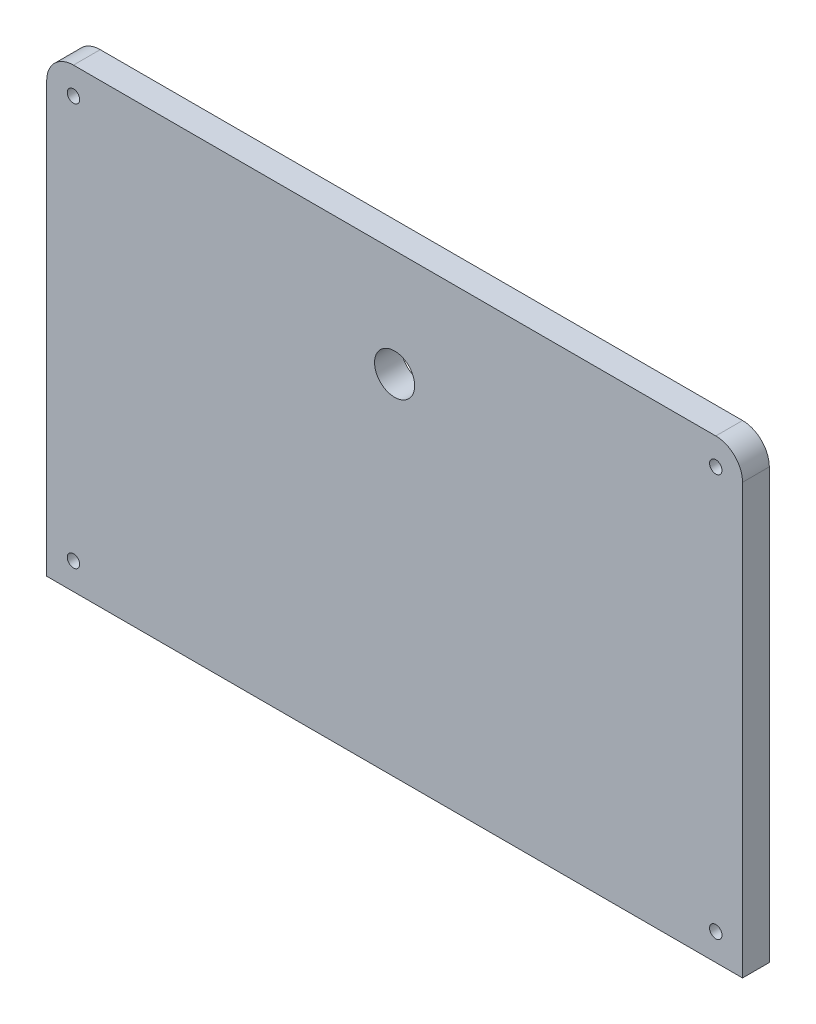
from build123d import *

# Parameters (mm, degrees)
SKETCH1_R           = 1.4732
SKETCH1_R_2         = 4.7625
BOSS_EXTRUDE1_DEPTH = 6.35


with BuildPart() as part:
    # Sketch1 → Boss-Extrude1 (new body)
    with BuildSketch(Plane.XY):
        with BuildLine():
            Line((0, 0), (0, 101.854))
            ThreePointArc((0, 101.854), (1.859871939, 106.344128061), (6.35, 108.204))
            Line((6.35, 108.204), (158.75, 108.204))
            ThreePointArc((158.75, 108.204), (163.240128061, 106.344128061), (165.1, 101.854))
            Line((165.1, 101.854), (165.1, 0))
            Line((165.1, 0), (0, 0))
        make_face()
        with Locations((6.35, 6.35)):
            Circle(SKETCH1_R, mode=Mode.SUBTRACT)
        with Locations((158.75, 6.35)):
            Circle(SKETCH1_R, mode=Mode.SUBTRACT)
        with Locations((158.75, 101.854)):
            Circle(SKETCH1_R, mode=Mode.SUBTRACT)
        with Locations((6.35, 101.854)):
            Circle(SKETCH1_R, mode=Mode.SUBTRACT)
        with Locations((82.55, 82.804)):
            Circle(SKETCH1_R_2, mode=Mode.SUBTRACT)
    extrude(amount=BOSS_EXTRUDE1_DEPTH)


solid = part.part
